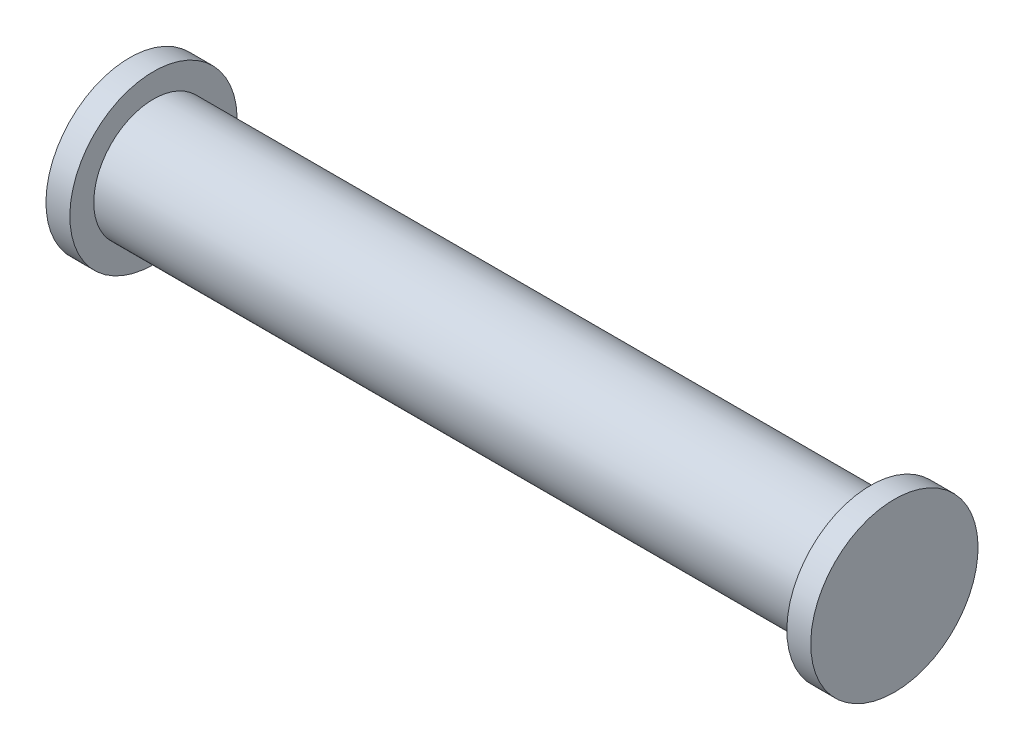
from build123d import *


with BuildPart() as part:
    # Sketch1 → Revolve1 (revolve)
    with BuildSketch(Plane.XY, mode=Mode.PRIVATE) as revolve1_sk:
        Polygon((-30, 5), (30, 5), (30, 7), (32, 7), (32, 0), (-32, 0), (-32, 7), (-30, 7), align=None)
    revolve(revolve1_sk.sketch.rotate(Axis((-32, 0, 0), (1, 0, 0)), 180), axis=Axis((-32, 0, 0), (1, 0, 0)))


solid = part.part
